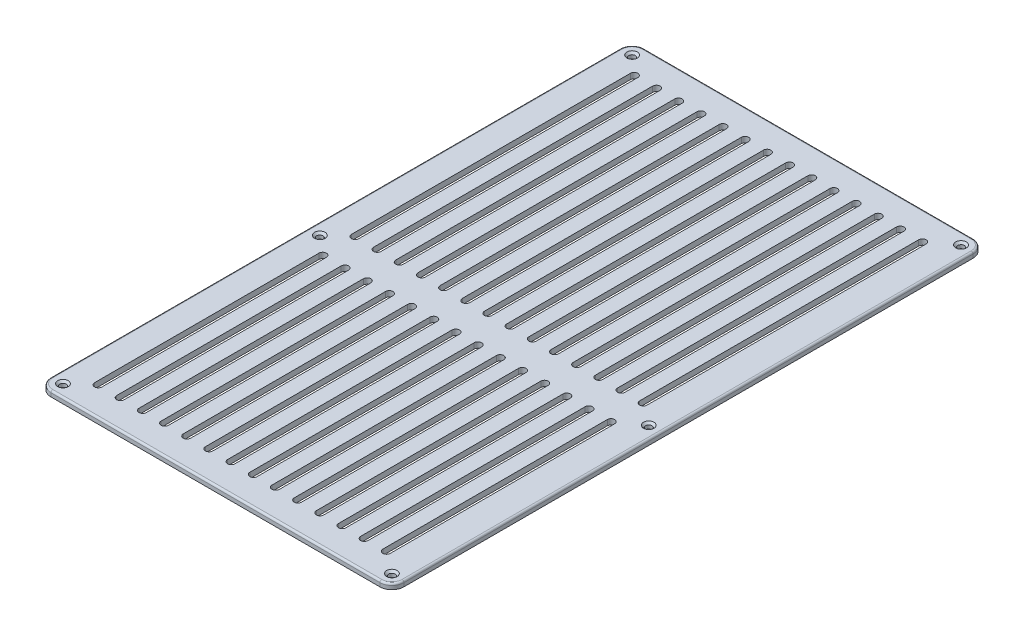
from build123d import *

# Parameters (mm, degrees)
SKETCH1_R           = 1.75
BOSS_EXTRUDE1_DEPTH = 3
CHAMFER1_SIZE       = 1.1
CUT_EXTRUDE1_DEPTH  = 38
CUT_EXTRUDE2_DEPTH  = 10
FILLET1_R           = 1


with BuildPart() as part:
    # Sketch1 → Boss-Extrude1 (new body)
    with BuildSketch(Plane(origin=(0, 0, 0), x_dir=(1, 0, 0), z_dir=(0, 1, 0))):
        with BuildLine():
            Line((0, 7), (0, 315))
            ThreePointArc((0, 315), (2.050252532, 319.949747468), (7, 322))
            Line((7, 322), (185, 322))
            ThreePointArc((185, 322), (189.949747468, 319.949747468), (192, 315))
            Line((192, 315), (192, 7))
            ThreePointArc((192, 7), (189.949747468, 2.050252532), (185, 0))
            Line((185, 0), (7, 0))
            ThreePointArc((7, 0), (2.050252532, 2.050252532), (0, 7))
        make_face()
        with Locations(Location((7, 315, 0), (0, 0, 270))):
            Circle(SKETCH1_R, mode=Mode.SUBTRACT)
        with Locations(Location((185, 315, 0), (0, 0, 270))):
            Circle(SKETCH1_R, mode=Mode.SUBTRACT)
        with Locations(Location((185, 7, 0), (0, 0, 270))):
            Circle(SKETCH1_R, mode=Mode.SUBTRACT)
        with Locations(Location((7, 7, 0), (0, 0, 270))):
            Circle(SKETCH1_R, mode=Mode.SUBTRACT)
        with Locations(Location((7, 146, 0), (0, 0, 270))):
            Circle(SKETCH1_R, mode=Mode.SUBTRACT)
        with Locations(Location((185, 146, 0), (0, 0, 270))):
            Circle(SKETCH1_R, mode=Mode.SUBTRACT)
    extrude(amount=BOSS_EXTRUDE1_DEPTH)

    # Chamfer1
    chamfer1_edges = [part.edges().sort_by_distance(p)[0] for p in [
        (7, 3, -316.75),
        (185, 3, -316.75),
        (185, 3, -8.75),
        (7, 3, -8.75),
        (7, 3, -147.75),
        (185, 3, -147.75),
    ]]
    chamfer(chamfer1_edges, length=CHAMFER1_SIZE)

    # Sketch2 → Cut-Extrude1 (cut)
    with BuildSketch(Plane(origin=(0, 3, 0), x_dir=(1, 0, 0), z_dir=(0, 1, 0))):
        with BuildLine():
            Line((31.1, 306), (31.1, 155))
            ThreePointArc((31.1, 155), (29.1, 153), (27.1, 155))
            Line((27.1, 155), (27.1, 306))
            ThreePointArc((27.1, 306), (29.1, 308), (31.1, 306))
        make_face()
        with BuildLine():
            Line((31.1, 16), (31.1, 137.46))
            ThreePointArc((31.1, 137.46), (29.1, 139.46), (27.1, 137.46))
            Line((27.1, 137.46), (27.1, 16))
            ThreePointArc((27.1, 16), (29.1, 14), (31.1, 16))
        make_face()
        with BuildLine():
            Line((15.1, 306), (15.1, 155))
            ThreePointArc((15.1, 155), (17.1, 153), (19.1, 155))
            Line((19.1, 155), (19.1, 306))
            ThreePointArc((19.1, 306), (17.1, 308), (15.1, 306))
        make_face()
        with BuildLine():
            Line((43.1, 306), (43.1, 155))
            ThreePointArc((43.1, 155), (41.1, 153), (39.1, 155))
            Line((39.1, 155), (39.1, 306))
            ThreePointArc((39.1, 306), (41.1, 308), (43.1, 306))
        make_face()
        with BuildLine():
            Line((43.1, 16), (43.1, 137.46))
            ThreePointArc((43.1, 137.46), (41.1, 139.46), (39.1, 137.46))
            Line((39.1, 137.46), (39.1, 16))
            ThreePointArc((39.1, 16), (41.1, 14), (43.1, 16))
        make_face()
        with BuildLine():
            Line((15.1, 16), (15.1, 137.46))
            ThreePointArc((15.1, 137.46), (17.1, 139.46), (19.1, 137.46))
            Line((19.1, 137.46), (19.1, 16))
            ThreePointArc((19.1, 16), (17.1, 14), (15.1, 16))
        make_face()
        with BuildLine():
            Line((55.1, 306), (55.1, 155))
            ThreePointArc((55.1, 155), (53.1, 153), (51.1, 155))
            Line((51.1, 155), (51.1, 306))
            ThreePointArc((51.1, 306), (53.1, 308), (55.1, 306))
        make_face()
        with BuildLine():
            Line((55.1, 16), (55.1, 137.46))
            ThreePointArc((55.1, 137.46), (53.1, 139.46), (51.1, 137.46))
            Line((51.1, 137.46), (51.1, 16))
            ThreePointArc((51.1, 16), (53.1, 14), (55.1, 16))
        make_face()
        with BuildLine():
            Line((67.1, 306), (67.1, 155))
            ThreePointArc((67.1, 155), (65.1, 153), (63.1, 155))
            Line((63.1, 155), (63.1, 306))
            ThreePointArc((63.1, 306), (65.1, 308), (67.1, 306))
        make_face()
        with BuildLine():
            Line((67.1, 16), (67.1, 137.46))
            ThreePointArc((67.1, 137.46), (65.1, 139.46), (63.1, 137.46))
            Line((63.1, 137.46), (63.1, 16))
            ThreePointArc((63.1, 16), (65.1, 14), (67.1, 16))
        make_face()
        with BuildLine():
            Line((79.1, 306), (79.1, 155))
            ThreePointArc((79.1, 155), (77.1, 153), (75.1, 155))
            Line((75.1, 155), (75.1, 306))
            ThreePointArc((75.1, 306), (77.1, 308), (79.1, 306))
        make_face()
        with BuildLine():
            Line((79.1, 16), (79.1, 137.46))
            ThreePointArc((79.1, 137.46), (77.1, 139.46), (75.1, 137.46))
            Line((75.1, 137.46), (75.1, 16))
            ThreePointArc((75.1, 16), (77.1, 14), (79.1, 16))
        make_face()
        with BuildLine():
            Line((91.1, 306), (91.1, 155))
            ThreePointArc((91.1, 155), (89.1, 153), (87.1, 155))
            Line((87.1, 155), (87.1, 306))
            ThreePointArc((87.1, 306), (89.1, 308), (91.1, 306))
        make_face()
        with BuildLine():
            Line((91.1, 16), (91.1, 137.46))
            ThreePointArc((91.1, 137.46), (89.1, 139.46), (87.1, 137.46))
            Line((87.1, 137.46), (87.1, 16))
            ThreePointArc((87.1, 16), (89.1, 14), (91.1, 16))
        make_face()
        with BuildLine():
            Line((103.1, 306), (103.1, 155))
            ThreePointArc((103.1, 155), (101.1, 153), (99.1, 155))
            Line((99.1, 155), (99.1, 306))
            ThreePointArc((99.1, 306), (101.1, 308), (103.1, 306))
        make_face()
        with BuildLine():
            Line((103.1, 16), (103.1, 137.46))
            ThreePointArc((103.1, 137.46), (101.1, 139.46), (99.1, 137.46))
            Line((99.1, 137.46), (99.1, 16))
            ThreePointArc((99.1, 16), (101.1, 14), (103.1, 16))
        make_face()
        with BuildLine():
            Line((115.1, 306), (115.1, 155))
            ThreePointArc((115.1, 155), (113.1, 153), (111.1, 155))
            Line((111.1, 155), (111.1, 306))
            ThreePointArc((111.1, 306), (113.1, 308), (115.1, 306))
        make_face()
        with BuildLine():
            Line((115.1, 16), (115.1, 137.46))
            ThreePointArc((115.1, 137.46), (113.1, 139.46), (111.1, 137.46))
            Line((111.1, 137.46), (111.1, 16))
            ThreePointArc((111.1, 16), (113.1, 14), (115.1, 16))
        make_face()
        with BuildLine():
            Line((127.1, 306), (127.1, 155))
            ThreePointArc((127.1, 155), (125.1, 153), (123.1, 155))
            Line((123.1, 155), (123.1, 306))
            ThreePointArc((123.1, 306), (125.1, 308), (127.1, 306))
        make_face()
        with BuildLine():
            Line((127.1, 16), (127.1, 137.46))
            ThreePointArc((127.1, 137.46), (125.1, 139.46), (123.1, 137.46))
            Line((123.1, 137.46), (123.1, 16))
            ThreePointArc((123.1, 16), (125.1, 14), (127.1, 16))
        make_face()
        with BuildLine():
            Line((139.1, 306), (139.1, 155))
            ThreePointArc((139.1, 155), (137.1, 153), (135.1, 155))
            Line((135.1, 155), (135.1, 306))
            ThreePointArc((135.1, 306), (137.1, 308), (139.1, 306))
        make_face()
        with BuildLine():
            Line((139.1, 16), (139.1, 137.46))
            ThreePointArc((139.1, 137.46), (137.1, 139.46), (135.1, 137.46))
            Line((135.1, 137.46), (135.1, 16))
            ThreePointArc((135.1, 16), (137.1, 14), (139.1, 16))
        make_face()
        with BuildLine():
            Line((151.1, 306), (151.1, 155))
            ThreePointArc((151.1, 155), (149.1, 153), (147.1, 155))
            Line((147.1, 155), (147.1, 306))
            ThreePointArc((147.1, 306), (149.1, 308), (151.1, 306))
        make_face()
        with BuildLine():
            Line((151.1, 16), (151.1, 137.46))
            ThreePointArc((151.1, 137.46), (149.1, 139.46), (147.1, 137.46))
            Line((147.1, 137.46), (147.1, 16))
            ThreePointArc((147.1, 16), (149.1, 14), (151.1, 16))
        make_face()
        with BuildLine():
            Line((163.1, 306), (163.1, 155))
            ThreePointArc((163.1, 155), (161.1, 153), (159.1, 155))
            Line((159.1, 155), (159.1, 306))
            ThreePointArc((159.1, 306), (161.1, 308), (163.1, 306))
        make_face()
        with BuildLine():
            Line((163.1, 16), (163.1, 137.46))
            ThreePointArc((163.1, 137.46), (161.1, 139.46), (159.1, 137.46))
            Line((159.1, 137.46), (159.1, 16))
            ThreePointArc((159.1, 16), (161.1, 14), (163.1, 16))
        make_face()
        with BuildLine():
            Line((175.1, 306), (175.1, 155))
            ThreePointArc((175.1, 155), (173.1, 153), (171.1, 155))
            Line((171.1, 155), (171.1, 306))
            ThreePointArc((171.1, 306), (173.1, 308), (175.1, 306))
        make_face()
        with BuildLine():
            Line((175.1, 16), (175.1, 137.46))
            ThreePointArc((175.1, 137.46), (173.1, 139.46), (171.1, 137.46))
            Line((171.1, 137.46), (171.1, 16))
            ThreePointArc((171.1, 16), (173.1, 14), (175.1, 16))
        make_face()
    extrude(amount=-CUT_EXTRUDE1_DEPTH, mode=Mode.SUBTRACT)

    # Sketch3 → Cut-Extrude2 (cut)
    with BuildSketch(Plane.XZ):
        with BuildLine():
            Line((185, 0), (7, 0))
            ThreePointArc((7, 0), (2.050252532, -2.050252532), (0, -7))
            Line((0, -7), (0, -315))
            ThreePointArc((0, -315), (2.050252532, -319.949747468), (7, -322))
            Line((7, -322), (185, -322))
            ThreePointArc((185, -322), (189.949747468, -319.949747468), (192, -315))
            Line((192, -315), (192, -7))
            ThreePointArc((192, -7), (189.949747468, -2.050252532), (185, 0))
        make_face()
        with BuildLine():
            Line((185, -0.5), (7, -0.5))
            ThreePointArc((7, -0.5), (2.403805922, -2.403805922), (0.5, -7))
            Line((0.5, -7), (0.5, -315))
            ThreePointArc((0.5, -315), (2.403805922, -319.596194078), (7, -321.5))
            Line((7, -321.5), (185, -321.5))
            ThreePointArc((185, -321.5), (189.596194078, -319.596194078), (191.5, -315))
            Line((191.5, -315), (191.5, -7))
            ThreePointArc((191.5, -7), (189.596194078, -2.403805922), (185, -0.5))
        make_face(mode=Mode.SUBTRACT)
    extrude(amount=-CUT_EXTRUDE2_DEPTH, mode=Mode.SUBTRACT)

    # Fillet1
    fillet1_edges = [part.edges().sort_by_distance(p)[0] for p in [
        (189.596194078, 3, -2.403805922),
        (191.5, 3, -161),
        (189.596194078, 3, -319.596194078),
        (96, 3, -321.5),
        (2.403805922, 3, -319.596194078),
        (0.5, 3, -161),
        (2.403805922, 3, -2.403805922),
        (96, 3, -0.5),
    ]]
    fillet(fillet1_edges, radius=FILLET1_R)


solid = part.part
